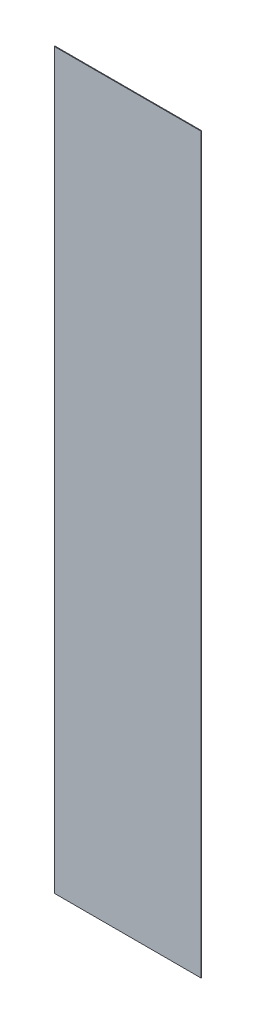
from build123d import *

# Parameters (mm, degrees)
CROQUIS1_W              = 400
CROQUIS1_H              = 2000
SALIENTE_EXTRUIR1_DEPTH = 1.9


with BuildPart() as part:
    # Croquis1 → Saliente-Extruir1 (new body)
    with BuildSketch(Plane.XY):
        Rectangle(CROQUIS1_W, CROQUIS1_H)
    extrude(amount=SALIENTE_EXTRUIR1_DEPTH)


solid = part.part
